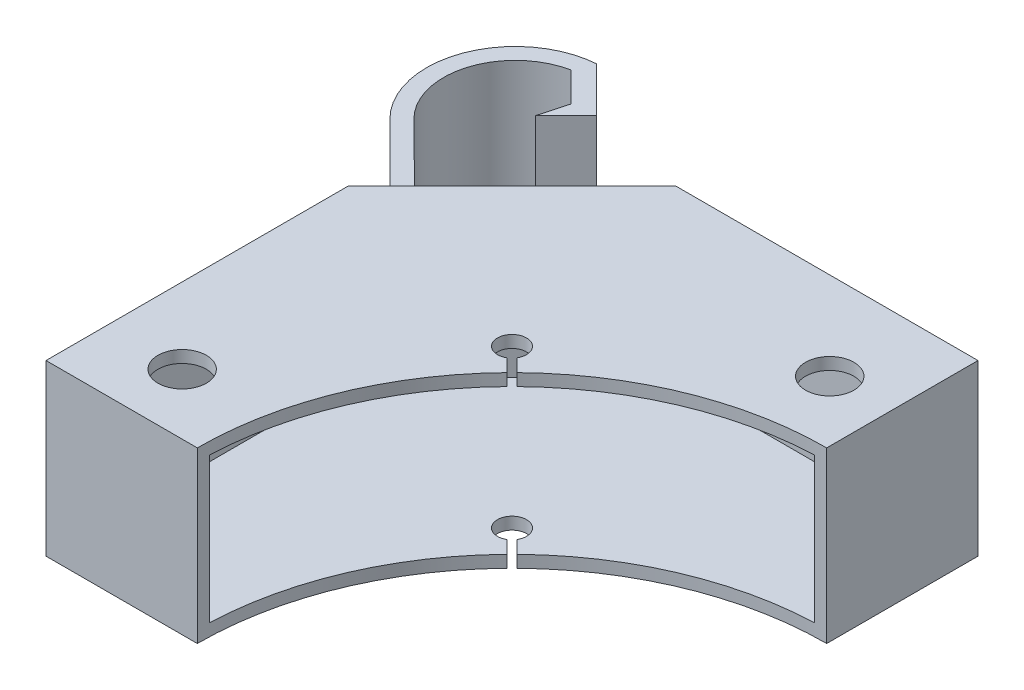
from build123d import *

# Parameters (mm, degrees)
BOSS_EXTRUDE1_DEPTH     = 28
SHELL1_T                = -2
CUT_EXTRUDE1_DEPTH      = 12
CUT_EXTRUDE1_DEPTH_BACK = 12
SKETCH9_R               = 6.4
SKETCH12_R              = 4
CUT_EXTRUDE3_DEPTH      = 2
SKETCH17_W              = 36.183766184
SKETCH17_H              = 26
BOSS_EXTRUDE2_DEPTH     = 30
CUT_EXTRUDE14_DEPTH     = 30


with BuildPart() as part:
    # Sketch1 → Boss-Extrude1 (new body)
    with BuildSketch(Plane(origin=(0, 0, 0), x_dir=(1, 0, 0), z_dir=(0, 1, 0))):
        with BuildLine():
            Line((0, 0), (0, 50))
            Line((0, 50), (27, 77))
            Line((27, 77), (77, 77))
            Line((77, 77), (77, 52))
            ThreePointArc((77, 52), (57.377961172, 48.155743087), (40.657159206, 37.191368932))
            Line((40.657159206, 37.191368932), (38.535838862, 39.312689275))
            ThreePointArc((38.535838862, 39.312689275), (34.771350846, 42.228649154), (37.687310725, 38.464161138))
            Line((37.687310725, 38.464161138), (39.808631068, 36.342840794))
            ThreePointArc((39.808631068, 36.342840794), (28.844256913, 19.622038828), (25, 0))
            Line((25, 0), (0, 0))
        make_face()
    extrude(amount=BOSS_EXTRUDE1_DEPTH)

    # Shell1
    shell1_openings = [part.faces().sort_by_distance(p)[0] for p in [
        (57.377961172, 14, -48.155743087),
        (28.844256913, 14, -19.622038828),
    ]]
    offset(amount=SHELL1_T, openings=shell1_openings, kind=Kind.INTERSECTION)

    # Sketch9 → Cut-Extrude1 (cut, two sides: drawn at the far end of the back side and taken through both)
    with BuildSketch(Plane(origin=(0, 14, 0), x_dir=(1, 0, 0), z_dir=(0, 1, 0)).offset(-CUT_EXTRUDE1_DEPTH_BACK)):
        with Locations((36.184678266, 38.815321734)):
            Circle(SKETCH9_R)
    extrude(amount=CUT_EXTRUDE1_DEPTH + CUT_EXTRUDE1_DEPTH_BACK, mode=Mode.SUBTRACT)

    # Sketch12 → Cut-Extrude3 (cut)
    with BuildSketch(Plane(origin=(0, 28, 0), x_dir=(1, 0, 0), z_dir=(0, 1, 0))):
        with Locations((67, 62.5)):
            Circle(SKETCH12_R)
        with Locations((12.5, 10)):
            Circle(SKETCH12_R)
    extrude(amount=-CUT_EXTRUDE3_DEPTH, mode=Mode.SUBTRACT)

    # Sketch17 → Boss-Extrude2 (add)
    with BuildSketch(Plane(origin=(-25, 0, -25), x_dir=(-0.7071067811865435, 0, 0.7071067811865516), z_dir=(-0.7071067811865516, 0, -0.7071067811865435))):
        with Locations((-54.447222151, 14)):
            Rectangle(SKETCH17_W, SKETCH17_H)
    extrude(amount=BOSS_EXTRUDE2_DEPTH)

    # Sketch19<7> → Cut-Extrude14 (cut)
    with BuildSketch(Plane(origin=(0, 27, 0), x_dir=(1, 0, 0), z_dir=(0, 1, 0))):
        with BuildLine():
            Line((-7.176599947, 64.001557861), (3.412478957, 53.412478957))
            Line((3.412478957, 53.412478957), (0.707106781, 50.707106781))
            Line((0.707106781, 50.707106781), (-20.506096654, 71.920310217))
            Line((-20.506096654, 71.920310217), (5.079689783, 97.506096654))
            Line((5.079689783, 97.506096654), (26.292893219, 76.292893219))
            Line((26.292893219, 76.292893219), (5.445665953, 55.445665953))
            Line((5.445665953, 55.445665953), (-5.153515959, 65.947132971))
            ThreePointArc((-5.153515959, 65.947132971), (-8.165921561, 77.734505129), (0.807292373, 85.950231609))
            Line((0.807292373, 85.950231609), (5.671042553, 81.08648143))
            Line((5.671042553, 81.08648143), (4.410448732, 76.512705214))
            Line((4.410448732, 76.512705214), (9.448954094, 81.551210575))
            Line((9.448954094, 81.551210575), (2.047814256, 88.952350413))
            ThreePointArc((2.047814256, 88.952350413), (-10.556487738, 79.431665635), (-7.176599947, 64.001557861))
        make_face()
    extrude(amount=-CUT_EXTRUDE14_DEPTH, mode=Mode.SUBTRACT)


solid = part.part
